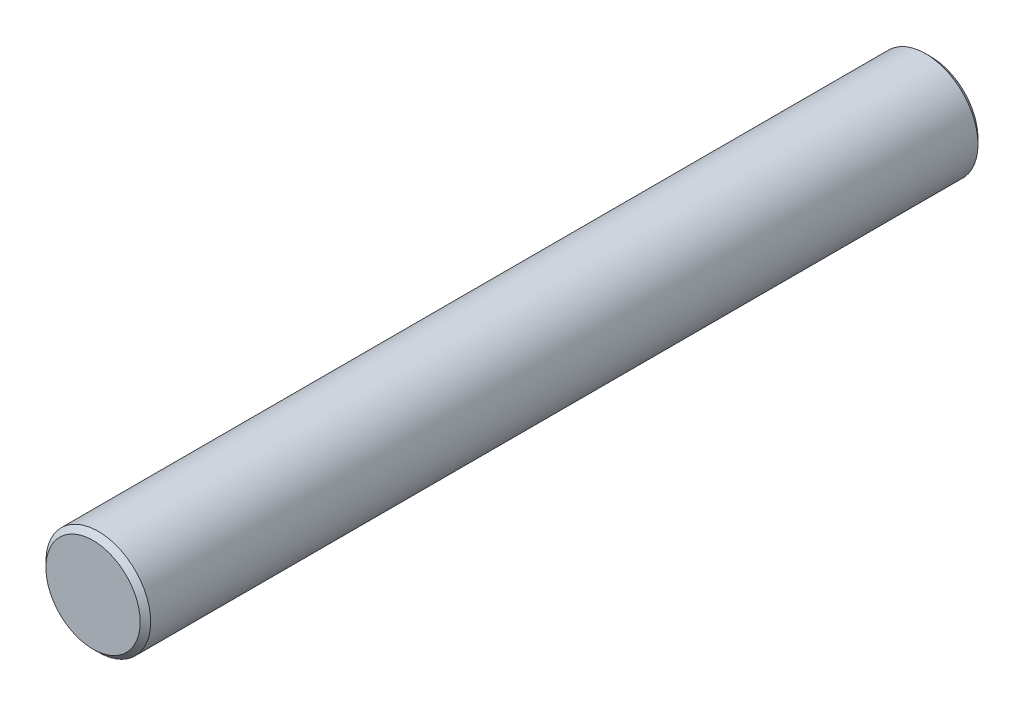
from build123d import *

# Parameters (mm, degrees)
SKETCH_1_R                   = 5
EXTRUDE_1_DEPTH              = 80
HOLE_WIZARD_M5_1_D           = 4.2
HOLE_WIZARD_M5_1_DEPTH       = 17.4
HOLE_WIZARD_M5_1_CBORE_D     = 5
HOLE_WIZARD_M5_1_CBORE_DEPTH = 15
HOLE_WIZARD_M5_1_TIP         = 1.2618073
CHAMFER_1_SIZE               = 0.5


with BuildPart() as part:
    # 草图1 → 拉伸1 (new body)
    with BuildSketch(Plane.XY):
        Circle(SKETCH_1_R)
    extrude(amount=EXTRUDE_1_DEPTH)

    # M5 螺纹孔1
    with Locations(Plane(origin=(0, 0, 0), x_dir=(-1, 0, 0), z_dir=(0, 0, -1))):
        with Locations((0, 0)):
            CounterBoreHole(HOLE_WIZARD_M5_1_D / 2, HOLE_WIZARD_M5_1_CBORE_D / 2, HOLE_WIZARD_M5_1_CBORE_DEPTH, depth=HOLE_WIZARD_M5_1_DEPTH)
            with Locations((0, 0, -(HOLE_WIZARD_M5_1_DEPTH + HOLE_WIZARD_M5_1_TIP / 2))):  # 118° drill point
                Cone(0, HOLE_WIZARD_M5_1_D / 2, HOLE_WIZARD_M5_1_TIP, mode=Mode.SUBTRACT)

    # 倒角1
    chamfer_1_edges = [part.edges().sort_by_distance(p)[0] for p in [
        (-5, 0, 0),
        (-5, 0, 80),
    ]]
    chamfer(chamfer_1_edges, length=CHAMFER_1_SIZE)


solid = part.part
